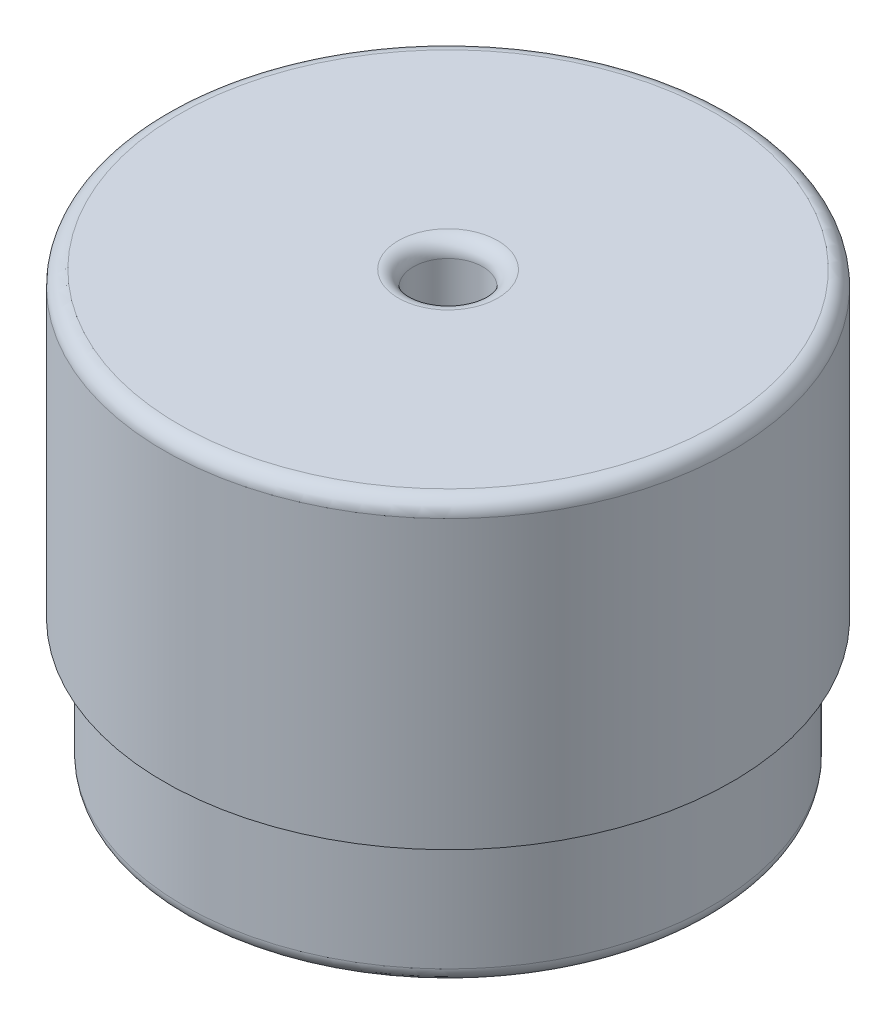
from build123d import *


with BuildPart() as part:
    # Sketch1 → Revolve1 (revolve)
    with BuildSketch(Plane.XY, mode=Mode.PRIVATE) as revolve1_sk:
        with BuildLine():
            Line((3.4925, -11.813333327), (3.4925, 28.88))
            ThreePointArc((3.4925, 28.88), (3.937697693, 29.954802307), (5.0125, 30.4))
            Line((5.0125, 30.4), (27.08, 30.4))
            ThreePointArc((27.08, 30.4), (28.154802307, 29.954802307), (28.6, 28.88))
            Line((28.6, 28.88), (28.6, 0))
            Line((28.6, 0), (27.172081158, 0))
            ThreePointArc((27.172081158, 0), (26.767558692, -0.167558692), (26.6, -0.572081158))
            Line((26.6, -0.572081158), (26.6, -11.813333327))
            ThreePointArc((26.6, -11.813333327), (26.154802307, -12.888135634), (25.08, -13.333333327))
            Line((25.08, -13.333333327), (5.0125, -13.333333327))
            ThreePointArc((5.0125, -13.333333327), (3.937697693, -12.888135634), (3.4925, -11.813333327))
        make_face()
    revolve(revolve1_sk.sketch.rotate(Axis((0, 0, 0), (0, 1, 0)), 90), axis=Axis((0, 0, 0), (0, 1, 0)))


solid = part.part
